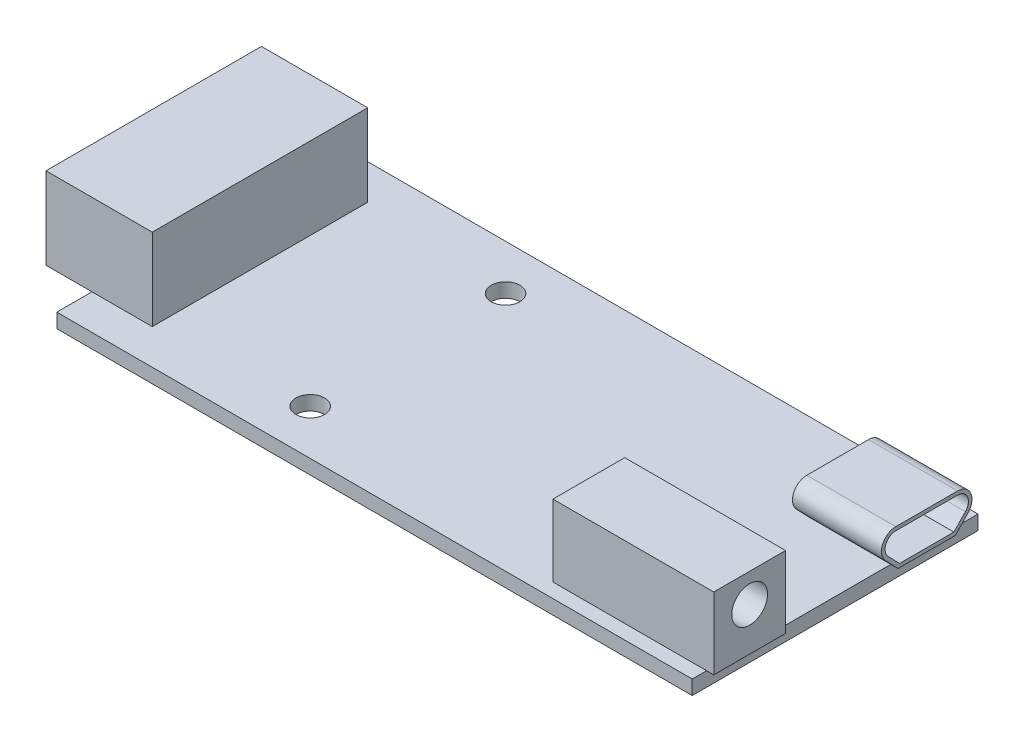
from build123d import *

# Parameters (mm, degrees)
SKETCH1_W                = 44.25
SKETCH1_H                = 19.9
SKETCH1_R                = 1
BOSS_EXTRUDE1_DEPTH      = 1
SKETCH2_W                = 7.4
SKETCH2_H                = 15
BOSS_EXTRUDE2_DEPTH      = 5.7
SKETCH3_W                = 13.6
SKETCH3_H                = 4.3
CUT_EXTRUDE1_DEPTH       = 6
SKETCH4_W                = 11.2
SKETCH4_H                = 5
BOSS_EXTRUDE3_DEPTH      = 5
SKETCH5_R                = 1.25
CUT_EXTRUDE2_DEPTH       = 8
BOSS_EXTRUDE4_DEPTH      = 0.5
BOSS_EXTRUDE4_DEPTH_BACK = 5.7


with BuildPart() as part:
    # Sketch1 → Boss-Extrude1 (new body)
    with BuildSketch(Plane(origin=(0, 0, 0), x_dir=(1, 0, 0), z_dir=(0, 1, 0))):
        Rectangle(SKETCH1_W, SKETCH1_H)
        with Locations(Location((-7.625, 6.8, 0), (0, 0, 270))):
            Circle(SKETCH1_R, mode=Mode.SUBTRACT)
        with Locations(Location((-7.625, -6.8, 0), (0, 0, 270))):
            Circle(SKETCH1_R, mode=Mode.SUBTRACT)
    extrude(amount=BOSS_EXTRUDE1_DEPTH)

    # Sketch2 → Boss-Extrude2 (add)
    with BuildSketch(Plane(origin=(0, 1, 0), x_dir=(1, 0, 0), z_dir=(0, 1, 0))):
        with Locations((-21.625, 0)):
            Rectangle(SKETCH2_W, SKETCH2_H)
    extrude(amount=BOSS_EXTRUDE2_DEPTH)

    # Sketch3 → Cut-Extrude1 (cut)
    with BuildSketch(Plane.ZY.offset(25.325)):
        with Locations((0, 3.85)):
            Rectangle(SKETCH3_W, SKETCH3_H)
    extrude(amount=-CUT_EXTRUDE1_DEPTH, mode=Mode.SUBTRACT)

    # Sketch4 → Boss-Extrude3 (add)
    with BuildSketch(Plane(origin=(0, 1, 0), x_dir=(1, 0, 0), z_dir=(0, 1, 0))):
        with Locations((17.025, -6.45)):
            Rectangle(SKETCH4_W, SKETCH4_H)
    extrude(amount=BOSS_EXTRUDE3_DEPTH)

    # Sketch5 → Cut-Extrude2 (cut)
    with BuildSketch(Plane(origin=(22.625, 0, 0), x_dir=(0, 0, -1), z_dir=(1, 0, 0))):
        with Locations((-6.45, 4)):
            Circle(SKETCH5_R)
    extrude(amount=-CUT_EXTRUDE2_DEPTH, mode=Mode.SUBTRACT)

    # Sketch6 → Boss-Extrude4 (add, two sides: drawn at the far end of the back side and taken through both)
    with BuildSketch(Plane(origin=(22.125, 0, 0), x_dir=(0, 0, -1), z_dir=(1, 0, 0)).offset(-BOSS_EXTRUDE4_DEPTH_BACK)):
        with BuildLine():
            Line((3.879166952, 1), (7.879166952, 1))
            Line((7.879166952, 1), (8.751177801, 1.906891284))
            ThreePointArc((8.751177801, 1.906891284), (8.950428623, 2.991721383), (8.030344737, 3.6))
            Line((8.030344737, 3.6), (3.727989167, 3.6))
            ThreePointArc((3.727989167, 3.6), (2.80790528, 2.991721383), (3.007156102, 1.906891284))
            Line((3.007156102, 1.906891284), (3.879166952, 1))
        make_face()
        with BuildLine():
            Line((3.985603275, 1.25), (7.772730629, 1.25))
            Line((7.772730629, 1.25), (8.570969535, 2.080168463))
            ThreePointArc((8.570969535, 2.080168463), (8.720407651, 2.893791037), (8.030344737, 3.35))
            Line((8.030344737, 3.35), (3.727989167, 3.35))
            ThreePointArc((3.727989167, 3.35), (3.037926252, 2.893791037), (3.187364368, 2.080168463))
            Line((3.187364368, 2.080168463), (3.985603275, 1.25))
        make_face(mode=Mode.SUBTRACT)
    extrude(amount=BOSS_EXTRUDE4_DEPTH + BOSS_EXTRUDE4_DEPTH_BACK)


solid = part.part
